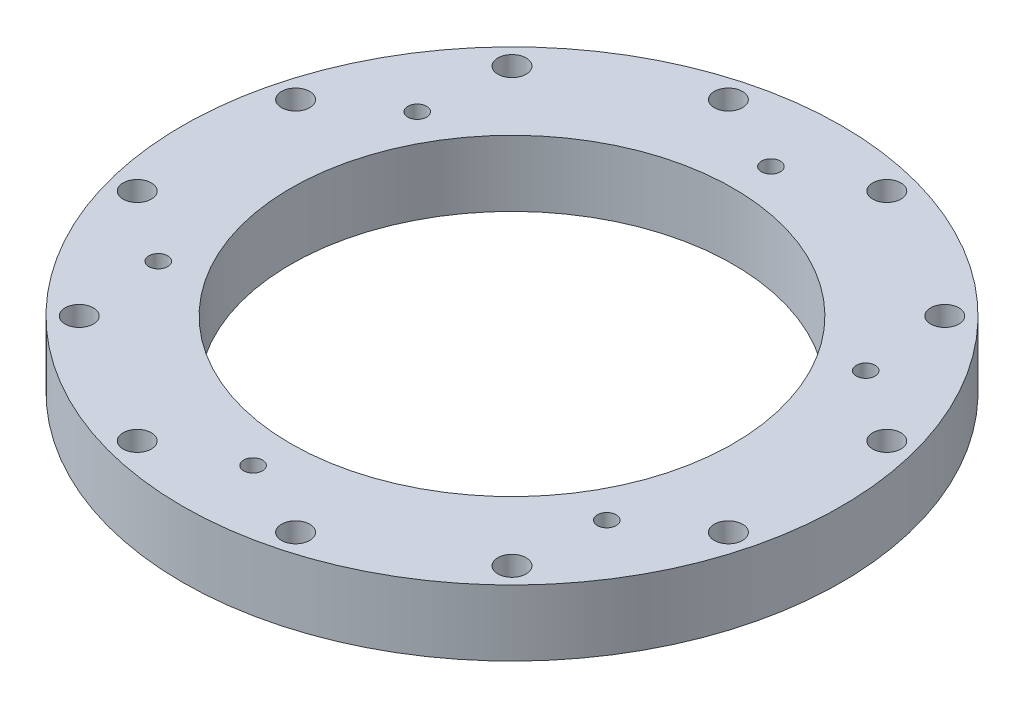
from build123d import *

# Parameters (mm, degrees)
SKETCH1_R           = 35
SKETCH1_R_2         = 23.5
SKETCH1_R_3         = 1
SKETCH1_R_4         = 1.5
BOSS_EXTRUDE1_DEPTH = 7


with BuildPart() as part:
    # Sketch1 → Boss-Extrude1 (new body)
    with BuildSketch(Plane(origin=(0, 0, 0), x_dir=(1, 0, 0), z_dir=(0, 1, 0))):
        with Locations(Location((0, 0, 0), (0, 0, 270))):
            Circle(SKETCH1_R)
        with Locations(Location((0, 0, 0), (0, 0, 270))):
            Circle(SKETCH1_R_2, mode=Mode.SUBTRACT)
        with Locations(Location((0, 27.5, 0), (0, 0, 270))):
            Circle(SKETCH1_R_3, mode=Mode.SUBTRACT)
        with Locations(Location((23.815698604, 13.75, 0), (0, 0, 270))):
            Circle(SKETCH1_R_3, mode=Mode.SUBTRACT)
        with Locations(Location((23.815698604, -13.75, 0), (0, 0, 270))):
            Circle(SKETCH1_R_3, mode=Mode.SUBTRACT)
        with Locations(Location((0, -27.5, 0), (0, 0, 270))):
            Circle(SKETCH1_R_3, mode=Mode.SUBTRACT)
        with Locations(Location((-23.815698604, -13.75, 0), (0, 0, 270))):
            Circle(SKETCH1_R_3, mode=Mode.SUBTRACT)
        with Locations(Location((-23.815698604, 13.75, 0), (0, 0, 270))):
            Circle(SKETCH1_R_3, mode=Mode.SUBTRACT)
        with Locations(Location((-31.392589354, -8.411618966, 0), (0, 0, 270))):
            Circle(SKETCH1_R_4, mode=Mode.SUBTRACT)
        with Locations(Location((-31.392589354, 8.411618966, 0), (0, 0, 270))):
            Circle(SKETCH1_R_4, mode=Mode.SUBTRACT)
        with Locations(Location((-22.980970389, 22.980970389, 0), (0, 0, 270))):
            Circle(SKETCH1_R_4, mode=Mode.SUBTRACT)
        with Locations(Location((-8.411618966, 31.392589354, 0), (0, 0, 270))):
            Circle(SKETCH1_R_4, mode=Mode.SUBTRACT)
        with Locations(Location((8.411618966, 31.392589354, 0), (0, 0, 270))):
            Circle(SKETCH1_R_4, mode=Mode.SUBTRACT)
        with Locations(Location((22.980970389, 22.980970389, 0), (0, 0, 270))):
            Circle(SKETCH1_R_4, mode=Mode.SUBTRACT)
        with Locations(Location((31.392589354, 8.411618966, 0), (0, 0, 270))):
            Circle(SKETCH1_R_4, mode=Mode.SUBTRACT)
        with Locations(Location((31.392589354, -8.411618966, 0), (0, 0, 270))):
            Circle(SKETCH1_R_4, mode=Mode.SUBTRACT)
        with Locations(Location((22.980970389, -22.980970389, 0), (0, 0, 270))):
            Circle(SKETCH1_R_4, mode=Mode.SUBTRACT)
        with Locations(Location((8.411618966, -31.392589354, 0), (0, 0, 270))):
            Circle(SKETCH1_R_4, mode=Mode.SUBTRACT)
        with Locations(Location((-8.411618966, -31.392589354, 0), (0, 0, 270))):
            Circle(SKETCH1_R_4, mode=Mode.SUBTRACT)
        with Locations(Location((-22.980970389, -22.980970389, 0), (0, 0, 270))):
            Circle(SKETCH1_R_4, mode=Mode.SUBTRACT)
    extrude(amount=BOSS_EXTRUDE1_DEPTH)


solid = part.part
